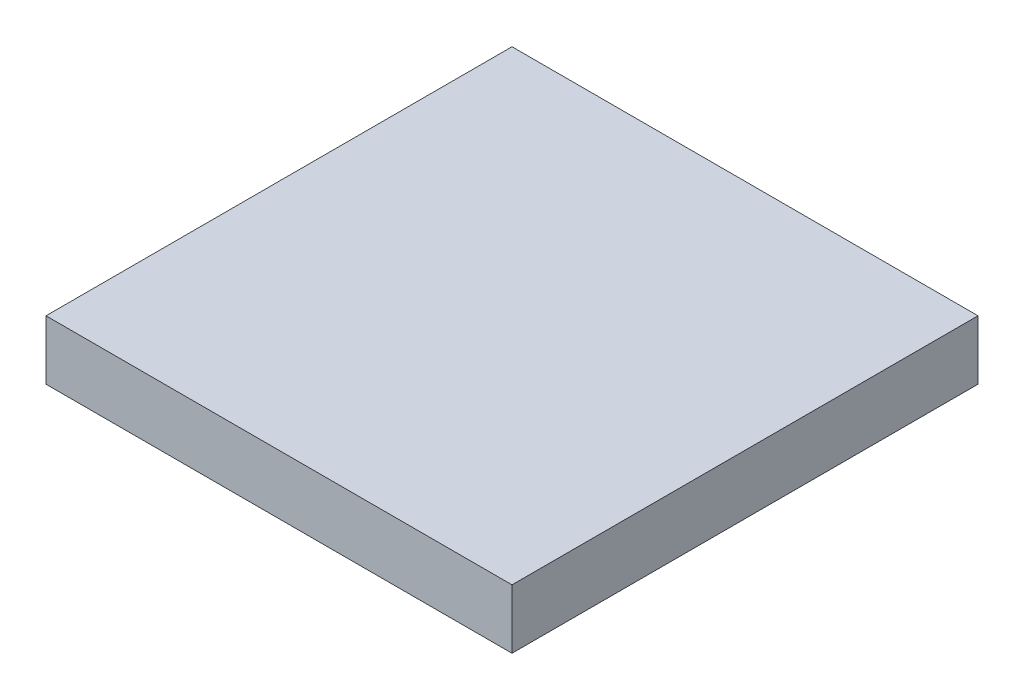
from build123d import *

# Parameters (mm, degrees)
SKETCH1_W           = 50
SKETCH1_H           = 50
BOSS_EXTRUDE1_DEPTH = 6.36


with BuildPart() as part:
    # Sketch1 → Boss-Extrude1 (new body)
    with BuildSketch(Plane(origin=(0, 0, 0), x_dir=(1, 0, 0), z_dir=(0, 1, 0))):
        with Locations((25, 25)):
            Rectangle(SKETCH1_W, SKETCH1_H)
    extrude(amount=BOSS_EXTRUDE1_DEPTH)


solid = part.part
